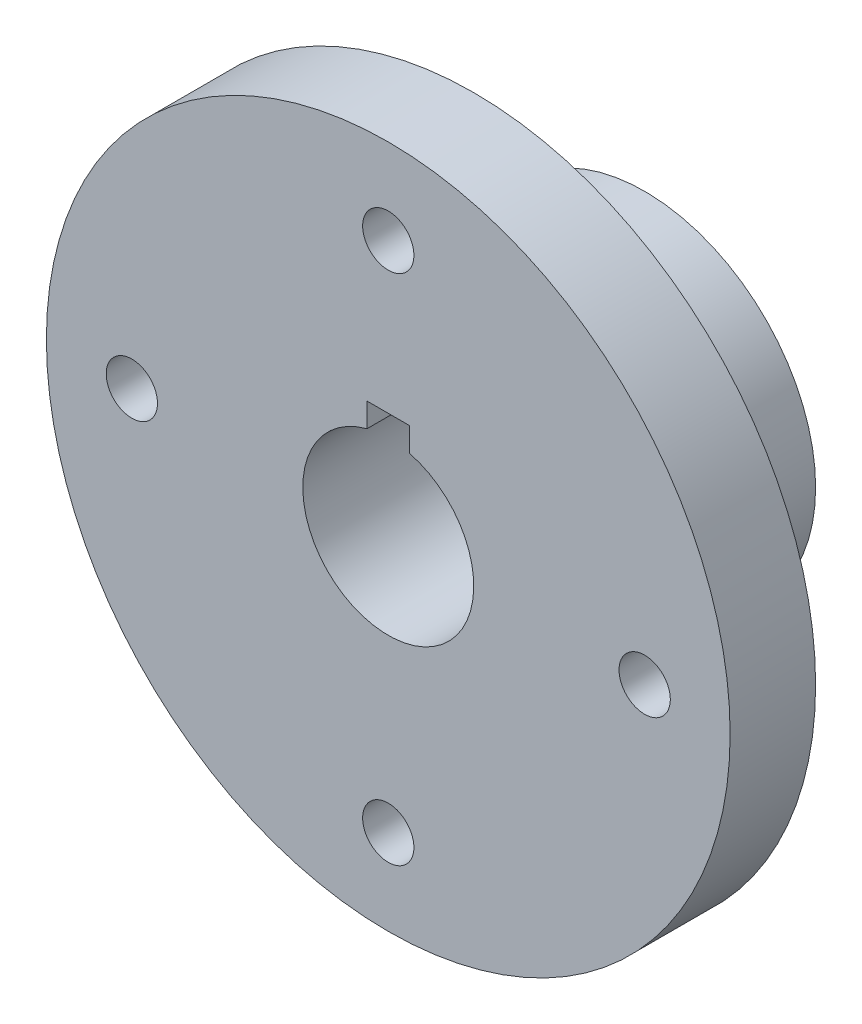
from build123d import *

# Parameters (mm, degrees)
SKETCH1_R           = 200
BOSS_EXTRUDE1_DEPTH = 50
SKETCH2_R           = 100
BOSS_EXTRUDE2_DEPTH = 100
SKETCH3_R           = 15
CUT_EXTRUDE1_DEPTH  = 321.156211872
SKETCH4_R           = 50
CUT_EXTRUDE2_DEPTH  = 321.156211872
SKETCH5_W           = 25
SKETCH5_H           = 25
CUT_EXTRUDE3_DEPTH  = 321.156211872


with BuildPart() as part:
    # Sketch1 → Boss-Extrude1 (new body)
    with BuildSketch(Plane.XY):
        Circle(SKETCH1_R)
    extrude(amount=BOSS_EXTRUDE1_DEPTH)

    # Sketch2 → Boss-Extrude2 (add)
    with BuildSketch(Plane(origin=(0, 0, 0), x_dir=(-1, 0, 0), z_dir=(0, 0, -1))):
        with Locations(Location((0, 0, 0), (0, 0, 180))):
            Circle(SKETCH2_R)
    extrude(amount=BOSS_EXTRUDE2_DEPTH)

    # Sketch3 → Cut-Extrude1 (cut, through all)
    with BuildSketch(Plane.XY.offset(50)):
        with Locations((0, 150)):
            Circle(SKETCH3_R)
        with Locations((150, 0)):
            Circle(SKETCH3_R)
        with Locations((0, -150)):
            Circle(SKETCH3_R)
        with Locations((-150, 0)):
            Circle(SKETCH3_R)
    extrude(amount=-CUT_EXTRUDE1_DEPTH, mode=Mode.SUBTRACT)

    # Sketch4 → Cut-Extrude2 (cut, through all)
    with BuildSketch(Plane.XY.offset(50)):
        Circle(SKETCH4_R)
    extrude(amount=-CUT_EXTRUDE2_DEPTH, mode=Mode.SUBTRACT)

    # Sketch5 → Cut-Extrude3 (cut, through all)
    with BuildSketch(Plane.XY.offset(50)):
        with Locations((0, 50)):
            Rectangle(SKETCH5_W, SKETCH5_H)
    extrude(amount=-CUT_EXTRUDE3_DEPTH, mode=Mode.SUBTRACT)


solid = part.part
